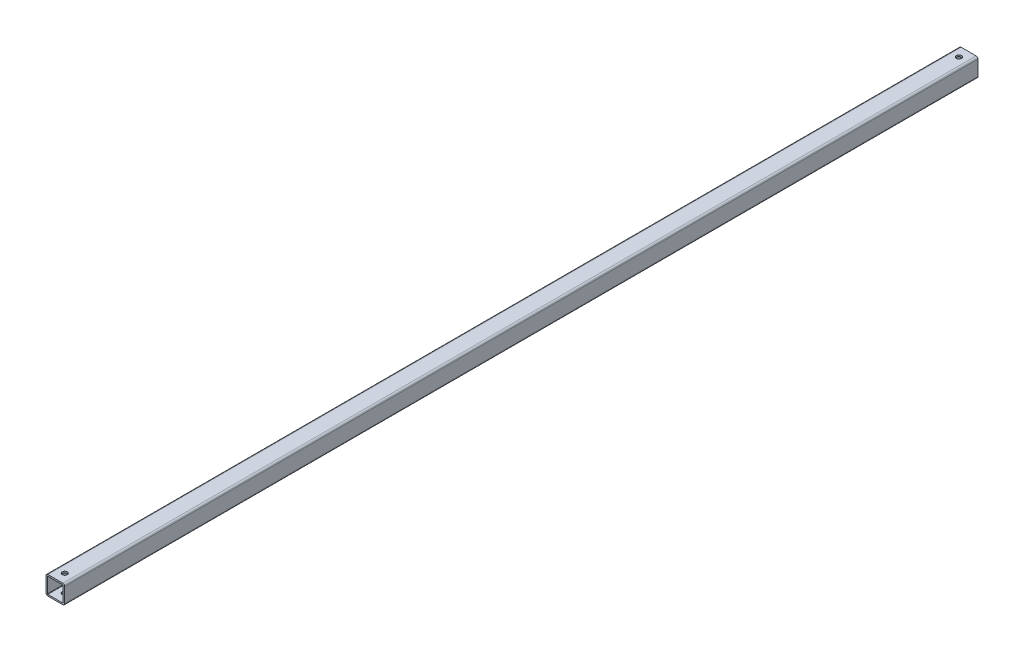
from build123d import *

# Parameters (mm, degrees)
EXTRUDE_THIN1_DEPTH         = 609.6
F_1_4_CLEARANCE_HOLE1_D     = 6.7564
F_1_4_CLEARANCE_HOLE1_DEPTH = 25.4
F_1_4_CLEARANCE_HOLE1_TIP   = 2.029827343


with BuildPart() as part:
    # Sketch1 → Extrude-Thin1 (new, symmetric)
    with BuildSketch(Plane.XY):
        with BuildLine():
            Line((-12.5, -10), (-12.5, 10))
            ThreePointArc((-12.5, 10), (-11.767766953, 11.767766953), (-10, 12.5))
            Line((-10, 12.5), (10, 12.5))
            ThreePointArc((10, 12.5), (11.767766953, 11.767766953), (12.5, 10))
            Line((12.5, 10), (12.5, -10))
            ThreePointArc((12.5, -10), (11.767766953, -11.767766953), (10, -12.5))
            Line((10, -12.5), (-10, -12.5))
            ThreePointArc((-10, -12.5), (-11.767766953, -11.767766953), (-12.5, -10))
        make_face()
        with BuildLine():
            Line((-10.5, -10), (-10.5, 10))
            ThreePointArc((-10.5, 10), (-10.353553391, 10.353553391), (-10, 10.5))
            Line((-10, 10.5), (10, 10.5))
            ThreePointArc((10, 10.5), (10.353553391, 10.353553391), (10.5, 10))
            Line((10.5, 10), (10.5, -10))
            ThreePointArc((10.5, -10), (10.353553391, -10.353553391), (10, -10.5))
            Line((10, -10.5), (-10, -10.5))
            ThreePointArc((-10, -10.5), (-10.353553391, -10.353553391), (-10.5, -10))
        make_face(mode=Mode.SUBTRACT)
    extrude(amount=EXTRUDE_THIN1_DEPTH, both=True)

    # 1/4 Clearance Hole1
    with Locations(Plane(origin=(0, 12.5, 0), x_dir=(1, 0, 0), z_dir=(0, 1, 0))):
        with Locations((-0.2, 596.9), (-0.2, -596.9)):
            Hole(F_1_4_CLEARANCE_HOLE1_D / 2, depth=F_1_4_CLEARANCE_HOLE1_DEPTH)
            with Locations((0, 0, -(F_1_4_CLEARANCE_HOLE1_DEPTH + F_1_4_CLEARANCE_HOLE1_TIP / 2))):  # 118° drill point
                Cone(0, F_1_4_CLEARANCE_HOLE1_D / 2, F_1_4_CLEARANCE_HOLE1_TIP, mode=Mode.SUBTRACT)


solid = part.part
